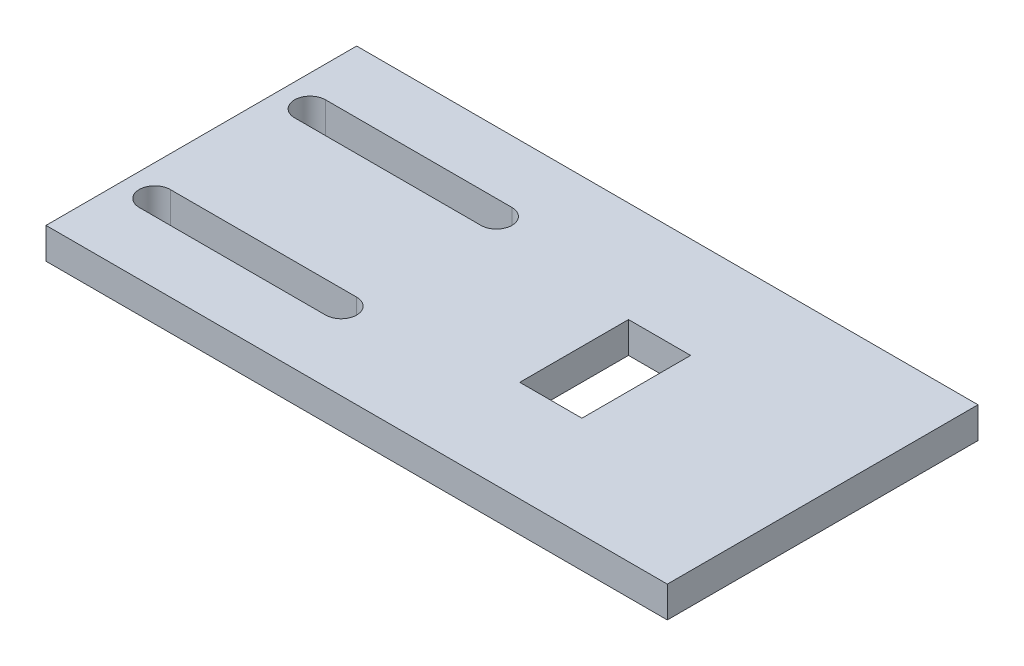
from build123d import *

# Parameters (mm, degrees)
SKETCH2_W           = 100
SKETCH2_H           = 50
BOSS_EXTRUDE1_DEPTH = 5
SKETCH3_W           = 10
SKETCH3_H           = 17.5
CUT_EXTRUDE1_DEPTH  = 7.5
CUT_EXTRUDE2_DEPTH  = 7.5


with BuildPart() as part:
    # Sketch2 → Boss-Extrude1 (new body)
    with BuildSketch(Plane(origin=(0, 0, 0), x_dir=(1, 0, 0), z_dir=(0, 1, 0))):
        Rectangle(SKETCH2_W, SKETCH2_H)
    extrude(amount=BOSS_EXTRUDE1_DEPTH)

    # Sketch3 → Cut-Extrude1 (cut)
    with BuildSketch(Plane(origin=(0, 5, 0), x_dir=(1, 0, 0), z_dir=(0, 1, 0))):
        with Locations((15, 0)):
            Rectangle(SKETCH3_W, SKETCH3_H)
    extrude(amount=-CUT_EXTRUDE1_DEPTH, mode=Mode.SUBTRACT)

    # Sketch4 → Cut-Extrude2 (cut)
    with BuildSketch(Plane(origin=(0, 5, 0), x_dir=(1, 0, 0), z_dir=(0, 1, 0))):
        with BuildLine():
            Line((-45, 15), (-15, 15))
            ThreePointArc((-15, 15), (-12.5, 12.5), (-15, 10))
            Line((-15, 10), (-45, 10))
            ThreePointArc((-45, 10), (-47.5, 12.5), (-45, 15))
        make_face()
        with BuildLine():
            Line((-45, -15), (-15, -15))
            ThreePointArc((-15, -15), (-12.5, -12.5), (-15, -10))
            Line((-15, -10), (-45, -10))
            ThreePointArc((-45, -10), (-47.5, -12.5), (-45, -15))
        make_face()
    extrude(amount=-CUT_EXTRUDE2_DEPTH, mode=Mode.SUBTRACT)


solid = part.part
